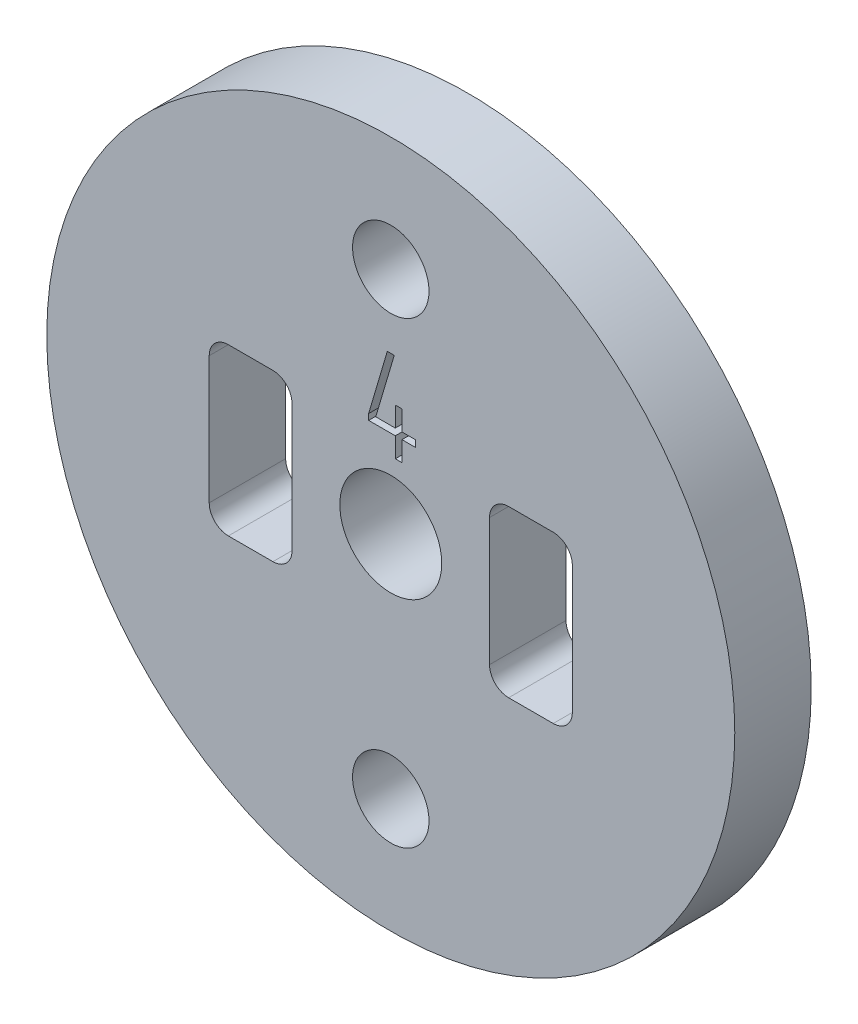
from build123d import *

# Parameters (mm, degrees)
MODEL_R                 = 13.5
MODEL_R_2               = 2
MODEL_R_3               = 1.5
SALIENTE_EXTRUIR1_DEPTH = 3


with BuildPart() as part:
    # Model → Saliente-Extruir1 (new body)
    with BuildSketch(Plane.XY):
        with Locations((21.167864369, 286.142389673)):
            Circle(MODEL_R)
        with Locations((21.167864369, 286.142389673)):
            Circle(MODEL_R_2, mode=Mode.SUBTRACT)
        with Locations((21.167864369, 295.142389673)):
            Circle(MODEL_R_3, mode=Mode.SUBTRACT)
        with Locations((21.167864369, 277.142389673)):
            Circle(MODEL_R_3, mode=Mode.SUBTRACT)
        with BuildLine():
            Line((27.542864369, 289.392389673), (25.792864369, 289.392389673))
            ThreePointArc((25.792864369, 289.392389673), (25.262534283, 289.172719759), (25.042864369, 288.642389673))
            Line((25.042864369, 288.642389673), (25.042864369, 283.642389673))
            ThreePointArc((25.042864369, 283.642389673), (25.262534283, 283.112059587), (25.792864369, 282.892389673))
            Line((25.792864369, 282.892389673), (27.542864369, 282.892389673))
            ThreePointArc((27.542864369, 282.892389673), (28.073194454, 283.112059587), (28.292864369, 283.642389673))
            Line((28.292864369, 283.642389673), (28.292864369, 288.642389673))
            ThreePointArc((28.292864369, 288.642389673), (28.073194454, 289.172719759), (27.542864369, 289.392389673))
        make_face(mode=Mode.SUBTRACT)
        with BuildLine():
            Line((14.792864369, 289.392389673), (16.542864369, 289.392389673))
            ThreePointArc((16.542864369, 289.392389673), (17.073194454, 289.172719759), (17.292864369, 288.642389673))
            Line((17.292864369, 288.642389673), (17.292864369, 283.642389673))
            ThreePointArc((17.292864369, 283.642389673), (17.073194454, 283.112059587), (16.542864369, 282.892389673))
            Line((16.542864369, 282.892389673), (14.792864369, 282.892389673))
            ThreePointArc((14.792864369, 282.892389673), (14.262534283, 283.112059587), (14.042864369, 283.642389673))
            Line((14.042864369, 283.642389673), (14.042864369, 288.642389673))
            ThreePointArc((14.042864369, 288.642389673), (14.262534283, 289.172719759), (14.792864369, 289.392389673))
        make_face(mode=Mode.SUBTRACT)
        Polygon((22.128307957, 289.571683654), (21.605919898, 289.571683654), (21.605919898, 288.788101564), (21.344725868, 288.788101564), (21.344725868, 289.571683654), (20.299949748, 289.571683654), (20.299949748, 289.804309587), (21.032925495, 292.288101564), (21.303914301, 292.283204176), (20.577468405, 289.832877684), (21.344725868, 289.832877684), (21.344725868, 290.616459773), (21.605919898, 290.616459773), (21.605919898, 289.832877684), (22.128307957, 289.832877684), align=None, mode=Mode.SUBTRACT)
    extrude(amount=SALIENTE_EXTRUIR1_DEPTH)


solid = part.part
